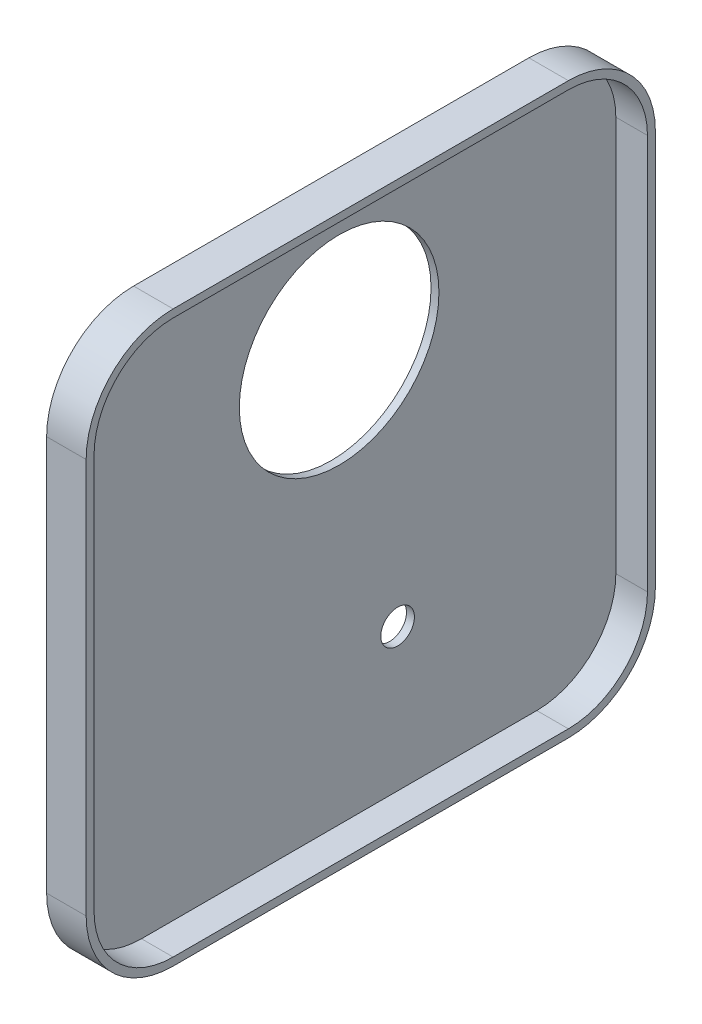
from build123d import *

# Parameters (mm, degrees)
SKETCH1_R           = 25.25
SKETCH1_R_2         = 4.25
BOSS_EXTRUDE1_DEPTH = 10
SHELL1_T            = -2
SKETCH2_R           = 63.400619105
CUT_EXTRUDE1_DEPTH  = 29


with BuildPart() as part:
    # Sketch1 → Boss-Extrude1 (new body)
    with BuildSketch(Plane.YZ):
        with BuildLine():
            Line((-50, 72), (50, 72))
            ThreePointArc((50, 72), (65.556349186, 65.556349186), (72, 50))
            Line((72, 50), (72, -50))
            ThreePointArc((72, -50), (65.556349186, -65.556349186), (50, -72))
            Line((50, -72), (-50, -72))
            ThreePointArc((-50, -72), (-65.556349186, -65.556349186), (-72, -50))
            Line((-72, -50), (-72, 50))
            ThreePointArc((-72, 50), (-65.556349186, 65.556349186), (-50, 72))
        make_face()
        with Locations(Location((34, 0, 0), (0, 0, 270))):
            Circle(SKETCH1_R, mode=Mode.SUBTRACT)
        with Locations(Location((-34, -14.79, 0), (0, 0, 270))):
            Circle(SKETCH1_R_2, mode=Mode.SUBTRACT)
    extrude(amount=BOSS_EXTRUDE1_DEPTH)

    # Shell1
    shell1_openings = [part.faces().sort_by_distance(p)[0] for p in [
        (10, -3.623679056, 0.045959525),
    ]]
    offset(amount=SHELL1_T, openings=shell1_openings, kind=Kind.INTERSECTION)

    # Sketch2 → Cut-Extrude1 (cut)
    with BuildSketch(Plane.YZ.offset(2)):
        Circle(SKETCH2_R)
    extrude(amount=CUT_EXTRUDE1_DEPTH, mode=Mode.SUBTRACT)


solid = part.part
